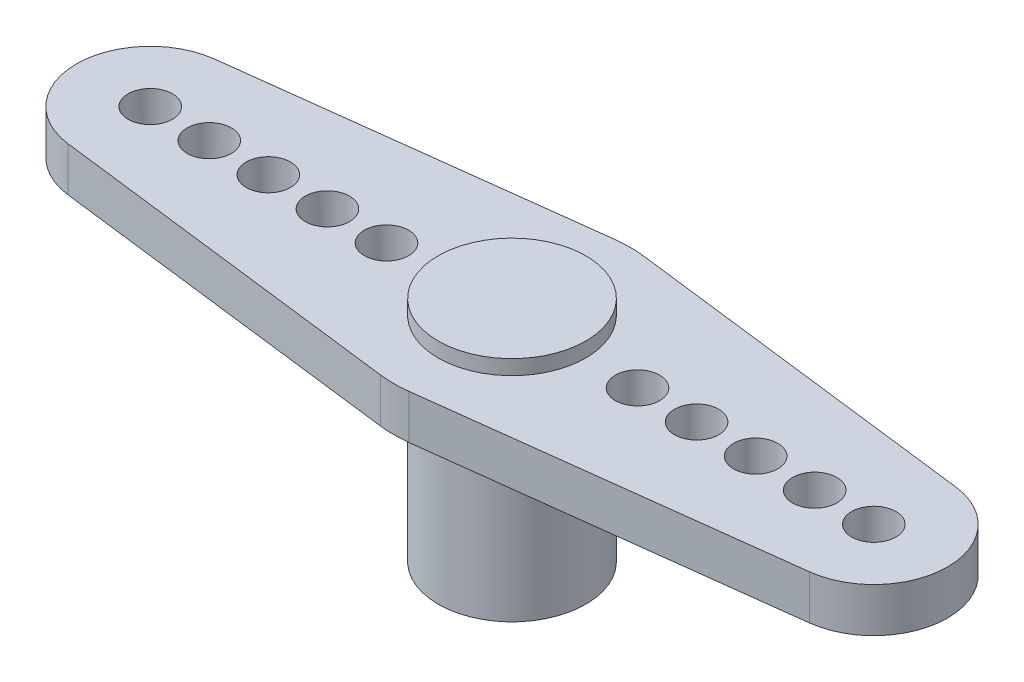
from build123d import *

# Parameters (mm, degrees)
SKETCH2_R           = 5
BOSS_EXTRUDE1_DEPTH = 8.44
SKETCH3_R           = 5
BOSS_EXTRUDE2_DEPTH = 6
BOSS_EXTRUDE3_DEPTH = 3
CUT_EXTRUDE1_REACH  = 35.805
SKETCH5_R           = 1.5
SKETCH6_R           = 5
BOSS_EXTRUDE4_DEPTH = 1


with BuildPart() as part:
    # Sketch2 → Boss-Extrude1 (new body)
    with BuildSketch(Plane(origin=(0, 0, 0), x_dir=(1, 0, 0), z_dir=(0, 1, 0))):
        with Locations(Location((0, 0, 0), (0, 0, 270))):
            Circle(SKETCH2_R)
    extrude(amount=BOSS_EXTRUDE1_DEPTH)

    # Sketch3 → Boss-Extrude2 (add)
    with BuildSketch(Plane(origin=(0, 8.44, 0), x_dir=(1, 0, 0), z_dir=(0, 1, 0))):
        with Locations(Location((0, 0, 0), (0, 0, 270))):
            Circle(SKETCH3_R)
    extrude(amount=BOSS_EXTRUDE2_DEPTH)

    # Sketch4 → Boss-Extrude3 (add)
    with BuildSketch(Plane(origin=(0, 14.44, 0), x_dir=(1, 0, 0), z_dir=(0, 1, 0))):
        with BuildLine():
            Line((-0.979591837, -7.939798476), (-25.112244898, -4.962374047))
            ThreePointArc((-25.112244898, -4.962374047), (-29.5, 0), (-25.112244898, 4.962374047))
            Line((-25.112244898, 4.962374047), (-0.979591837, 7.939798476))
            ThreePointArc((-0.979591837, 7.939798476), (0, 8), (0.979591837, 7.939798476))
            Line((0.979591837, 7.939798476), (25.112244898, 4.962374047))
            ThreePointArc((25.112244898, 4.962374047), (29.5, 0), (25.112244898, -4.962374047))
            Line((25.112244898, -4.962374047), (0.979591837, -7.939798476))
            ThreePointArc((0.979591837, -7.939798476), (0, -8), (-0.979591837, -7.939798476))
        make_face()
    extrude(amount=-BOSS_EXTRUDE3_DEPTH)

    # Sketch5 → Cut-Extrude1 (cut, up to next)
    with BuildSketch(Plane(origin=(0, 14.44, 0), x_dir=(1, 0, 0), z_dir=(0, 1, 0)), mode=Mode.PRIVATE) as cut_extrude1_sk1:
        with Locations(Location((24.5, 0, 0), (0, 0, 270))):
            Circle(SKETCH5_R)
    cut_extrude1_tool1 = extrude(cut_extrude1_sk1.sketch, amount=-CUT_EXTRUDE1_REACH, mode=Mode.PRIVATE) & part.part
    # Sketch5 → Cut-Extrude1 (cut, up to next)
    with BuildSketch(Plane(origin=(0, 14.44, 0), x_dir=(1, 0, 0), z_dir=(0, 1, 0)), mode=Mode.PRIVATE) as cut_extrude1_sk2:
        with Locations(Location((20.5, 0, 0), (0, 0, 270))):
            Circle(SKETCH5_R)
    cut_extrude1_tool2 = extrude(cut_extrude1_sk2.sketch, amount=-CUT_EXTRUDE1_REACH, mode=Mode.PRIVATE) & part.part
    # Sketch5 → Cut-Extrude1 (cut, up to next)
    with BuildSketch(Plane(origin=(0, 14.44, 0), x_dir=(1, 0, 0), z_dir=(0, 1, 0)), mode=Mode.PRIVATE) as cut_extrude1_sk3:
        with Locations(Location((16.5, 0, 0), (0, 0, 270))):
            Circle(SKETCH5_R)
    cut_extrude1_tool3 = extrude(cut_extrude1_sk3.sketch, amount=-CUT_EXTRUDE1_REACH, mode=Mode.PRIVATE) & part.part
    # Sketch5 → Cut-Extrude1 (cut, up to next)
    with BuildSketch(Plane(origin=(0, 14.44, 0), x_dir=(1, 0, 0), z_dir=(0, 1, 0)), mode=Mode.PRIVATE) as cut_extrude1_sk4:
        with Locations(Location((12.5, 0, 0), (0, 0, 270))):
            Circle(SKETCH5_R)
    cut_extrude1_tool4 = extrude(cut_extrude1_sk4.sketch, amount=-CUT_EXTRUDE1_REACH, mode=Mode.PRIVATE) & part.part
    # Sketch5 → Cut-Extrude1 (cut, up to next)
    with BuildSketch(Plane(origin=(0, 14.44, 0), x_dir=(1, 0, 0), z_dir=(0, 1, 0)), mode=Mode.PRIVATE) as cut_extrude1_sk5:
        with Locations(Location((8.5, 0, 0), (0, 0, 270))):
            Circle(SKETCH5_R)
    cut_extrude1_tool5 = extrude(cut_extrude1_sk5.sketch, amount=-CUT_EXTRUDE1_REACH, mode=Mode.PRIVATE) & part.part
    # Sketch5 → Cut-Extrude1 (cut, up to next)
    with BuildSketch(Plane(origin=(0, 14.44, 0), x_dir=(1, 0, 0), z_dir=(0, 1, 0)), mode=Mode.PRIVATE) as cut_extrude1_sk6:
        with Locations(Location((-24.5, 0, 0), (0, 0, 270))):
            Circle(SKETCH5_R)
    cut_extrude1_tool6 = extrude(cut_extrude1_sk6.sketch, amount=-CUT_EXTRUDE1_REACH, mode=Mode.PRIVATE) & part.part
    # Sketch5 → Cut-Extrude1 (cut, up to next)
    with BuildSketch(Plane(origin=(0, 14.44, 0), x_dir=(1, 0, 0), z_dir=(0, 1, 0)), mode=Mode.PRIVATE) as cut_extrude1_sk7:
        with Locations(Location((-8.5, 0, 0), (0, 0, 270))):
            Circle(SKETCH5_R)
    cut_extrude1_tool7 = extrude(cut_extrude1_sk7.sketch, amount=-CUT_EXTRUDE1_REACH, mode=Mode.PRIVATE) & part.part
    # Sketch5 → Cut-Extrude1 (cut, up to next)
    with BuildSketch(Plane(origin=(0, 14.44, 0), x_dir=(1, 0, 0), z_dir=(0, 1, 0)), mode=Mode.PRIVATE) as cut_extrude1_sk8:
        with Locations(Location((-12.5, 0, 0), (0, 0, 270))):
            Circle(SKETCH5_R)
    cut_extrude1_tool8 = extrude(cut_extrude1_sk8.sketch, amount=-CUT_EXTRUDE1_REACH, mode=Mode.PRIVATE) & part.part
    # Sketch5 → Cut-Extrude1 (cut, up to next)
    with BuildSketch(Plane(origin=(0, 14.44, 0), x_dir=(1, 0, 0), z_dir=(0, 1, 0)), mode=Mode.PRIVATE) as cut_extrude1_sk9:
        with Locations(Location((-16.5, 0, 0), (0, 0, 270))):
            Circle(SKETCH5_R)
    cut_extrude1_tool9 = extrude(cut_extrude1_sk9.sketch, amount=-CUT_EXTRUDE1_REACH, mode=Mode.PRIVATE) & part.part
    # Sketch5 → Cut-Extrude1 (cut, up to next)
    with BuildSketch(Plane(origin=(0, 14.44, 0), x_dir=(1, 0, 0), z_dir=(0, 1, 0)), mode=Mode.PRIVATE) as cut_extrude1_sk10:
        with Locations(Location((-20.5, 0, 0), (0, 0, 270))):
            Circle(SKETCH5_R)
    cut_extrude1_tool10 = extrude(cut_extrude1_sk10.sketch, amount=-CUT_EXTRUDE1_REACH, mode=Mode.PRIVATE) & part.part
    add(cut_extrude1_tool1.solids().sort_by_distance((24.5, 14.44, 0))[0], mode=Mode.SUBTRACT)
    add(cut_extrude1_tool2.solids().sort_by_distance((20.5, 14.44, 0))[0], mode=Mode.SUBTRACT)
    add(cut_extrude1_tool3.solids().sort_by_distance((16.5, 14.44, 0))[0], mode=Mode.SUBTRACT)
    add(cut_extrude1_tool4.solids().sort_by_distance((12.5, 14.44, 0))[0], mode=Mode.SUBTRACT)
    add(cut_extrude1_tool5.solids().sort_by_distance((8.5, 14.44, 0))[0], mode=Mode.SUBTRACT)
    add(cut_extrude1_tool6.solids().sort_by_distance((-24.5, 14.44, 0))[0], mode=Mode.SUBTRACT)
    add(cut_extrude1_tool7.solids().sort_by_distance((-8.5, 14.44, 0))[0], mode=Mode.SUBTRACT)
    add(cut_extrude1_tool8.solids().sort_by_distance((-12.5, 14.44, 0))[0], mode=Mode.SUBTRACT)
    add(cut_extrude1_tool9.solids().sort_by_distance((-16.5, 14.44, 0))[0], mode=Mode.SUBTRACT)
    add(cut_extrude1_tool10.solids().sort_by_distance((-20.5, 14.44, 0))[0], mode=Mode.SUBTRACT)

    # Sketch6 → Boss-Extrude4 (add)
    with BuildSketch(Plane(origin=(0, 14.44, 0), x_dir=(1, 0, 0), z_dir=(0, 1, 0))):
        with Locations(Location((0, 0, 0), (0, 0, 270))):
            Circle(SKETCH6_R)
    extrude(amount=BOSS_EXTRUDE4_DEPTH)


solid = part.part
